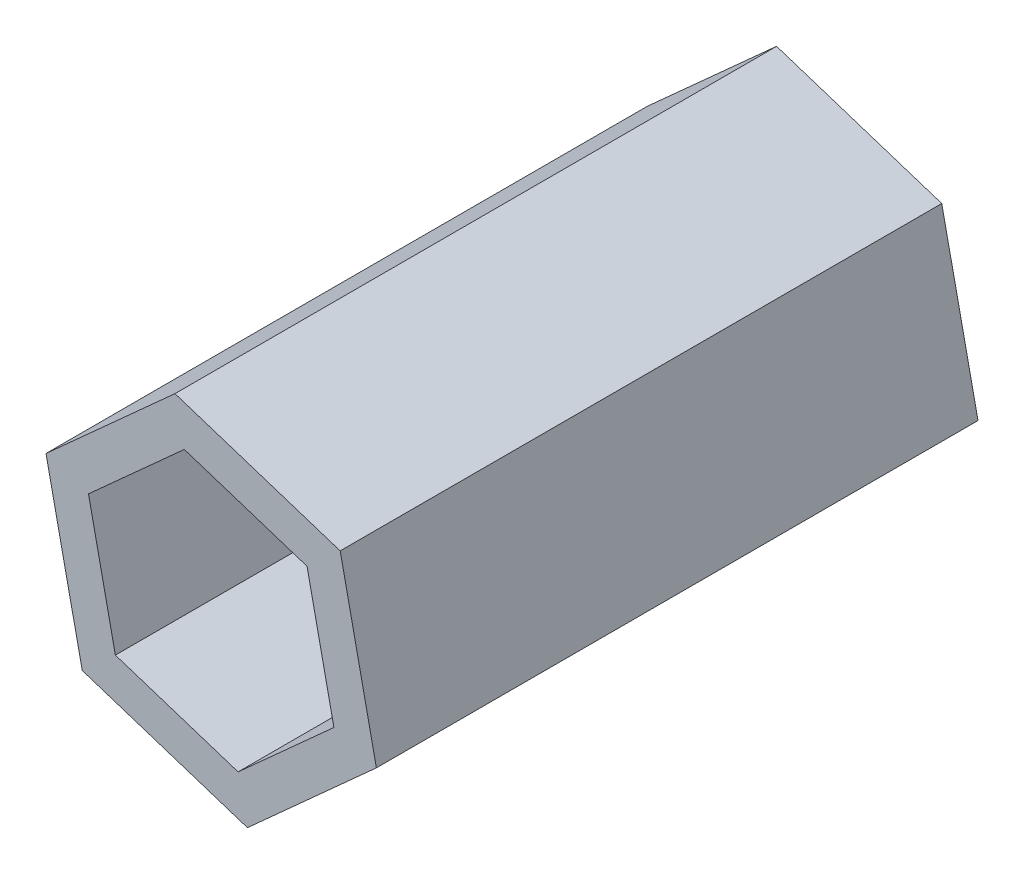
from build123d import *

# Parameters (mm, degrees)
RESSALTO_EXTRUS_O1_DEPTH = 14
CORTE_EXTRUS_O1_DEPTH    = 10.6
CORTE_EXTRUS_O2_REACH    = 17.047
ESBO_O3_R                = 0.75


with BuildPart() as part:
    # Esboço1 → Ressalto-extrusão1 (new body)
    with BuildSketch(Plane.XY):
        Polygon((-0.842772028, 3.952602768), (-3.844440422, 1.246439398), (-3.001668394, -2.70616337), (0.842772028, -3.952602768), (3.844440422, -1.246439398), (3.001668394, 2.70616337), align=None)
    extrude(amount=RESSALTO_EXTRUS_O1_DEPTH)

    # Esboço2 → Corte-extrusão1 (cut)
    with BuildSketch(Plane.XY.offset(14)):
        Polygon((2.229810807, 2.010292789), (-0.626059221, 2.936219199), (-2.855870028, 0.92592641), (-2.229810807, -2.010292789), (0.626059221, -2.936219199), (2.855870028, -0.92592641), align=None)
    extrude(amount=-CORTE_EXTRUS_O1_DEPTH, mode=Mode.SUBTRACT)

    # Esboço3 → Corte-extrusão2 (cut, up to next)
    with BuildSketch(Plane(origin=(0, 0, 0), x_dir=(-1, 0, 0), z_dir=(0, 0, -1)), mode=Mode.PRIVATE) as corte_extrus_o2_sk1:
        Circle(ESBO_O3_R)
    corte_extrus_o2_tool1 = extrude(corte_extrus_o2_sk1.sketch, amount=-CORTE_EXTRUS_O2_REACH, mode=Mode.PRIVATE) & part.part
    add(corte_extrus_o2_tool1.solids().sort_by_distance((0, 0, 0))[0], mode=Mode.SUBTRACT)


solid = part.part
